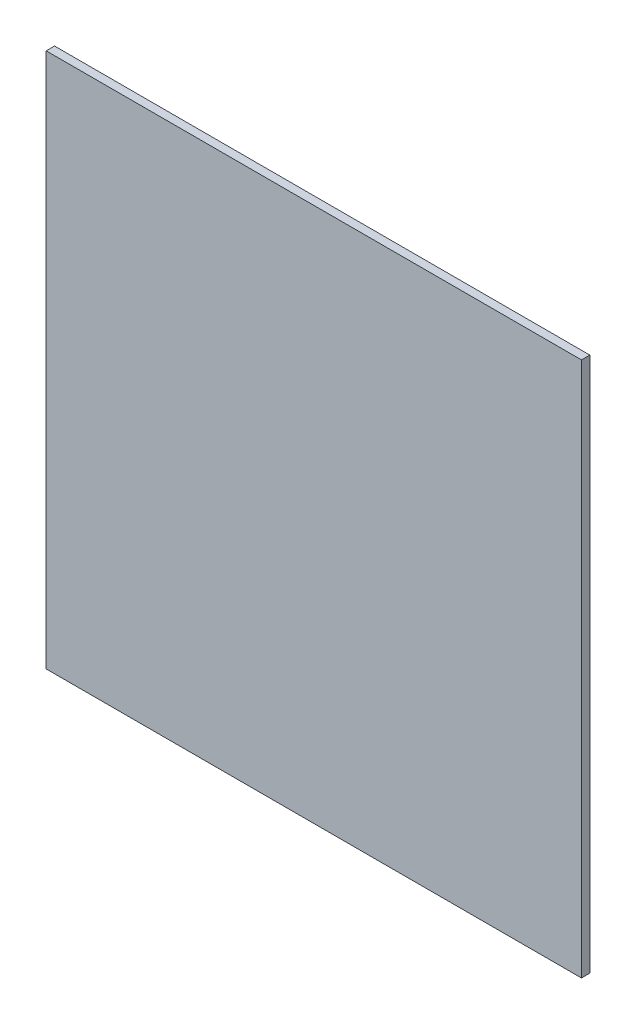
from build123d import *

# Parameters (mm, degrees)
SKETCH2_R           = 584.2
SKETCH2_R_2         = 533.4
BOSS_EXTRUDE1_DEPTH = 19.05
SKETCH3_W           = 1219.2
SKETCH3_H           = 1219.2
STOCK_DEPTH         = 19.05


with BuildPart() as part:
    # Sketch2 → Boss-Extrude1 (new body)
    with BuildSketch(Plane.XY):
        with Locations(Location((0, 0, 0), (0, 0, 180))):
            Circle(SKETCH2_R)
        with Locations(Location((0, 0, 0), (0, 0, 180))):
            Circle(SKETCH2_R_2, mode=Mode.SUBTRACT)
    extrude(amount=BOSS_EXTRUDE1_DEPTH)


with BuildPart() as body_2:
    # Sketch3 → Stock (new body)
    with BuildSketch(Plane.XY.offset(19.05)):
        Rectangle(SKETCH3_W, SKETCH3_H)
    extrude(amount=-STOCK_DEPTH)


solid = Compound([part.part, body_2.part])
